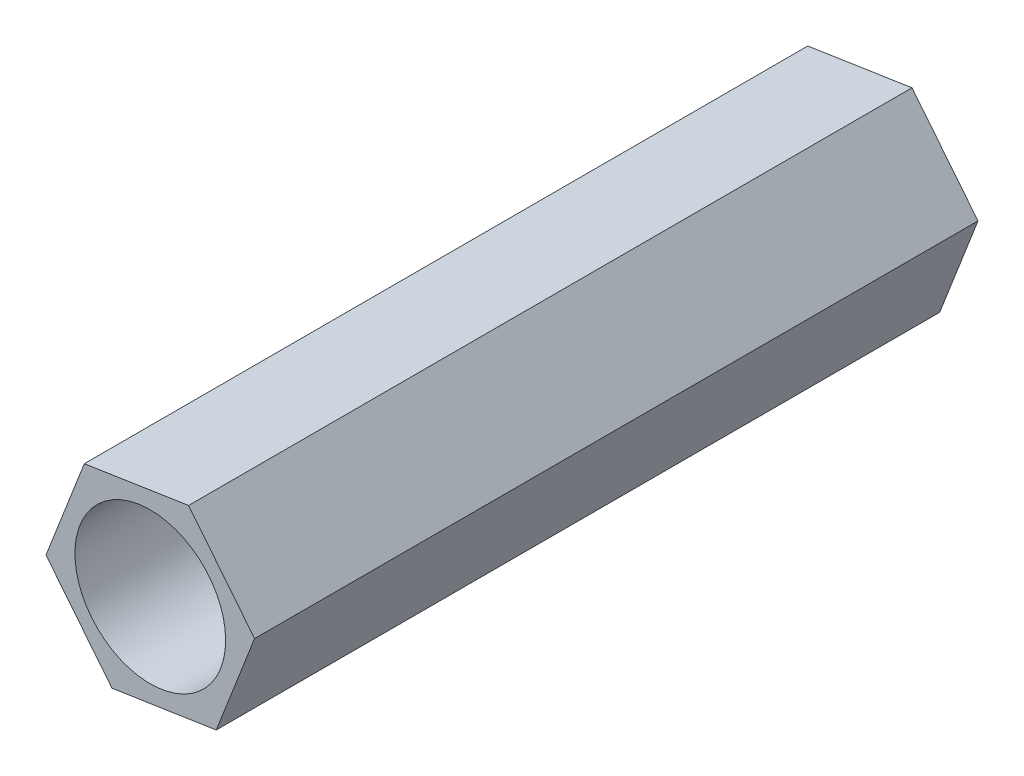
from build123d import *

# Parameters (mm, degrees)
SKETCH1_R           = 1.75
SKETCH1_R_2         = 1.25
BOSS_EXTRUDE1_DEPTH = 12
CUT_EXTRUDE2_START  = -12
CUT_EXTRUDE2_DEPTH  = 12


with BuildPart() as part:
    # Sketch1 → Boss-Extrude1 (new body)
    with BuildSketch(Plane.XY):
        Circle(SKETCH1_R)
        Circle(SKETCH1_R_2, mode=Mode.SUBTRACT)
    extrude(amount=BOSS_EXTRUDE1_DEPTH)

    # Sketch2 → Cut-Extrude2 (cut)
    with BuildSketch(Plane.XY.offset(12).offset(CUT_EXTRUDE2_START)):
        with BuildLine():
            ThreePointArc((-1.09434695, 1.365615156), (-1.630539837, 0.635483942), (-1.729830892, -0.264924681))
            Line((-1.729830892, -0.264924681), (-1.09434695, 1.365615156))
        make_face()
        with BuildLine():
            Line((-1.09434695, 1.365615156), (0.635483942, 1.630539837))
            ThreePointArc((0.635483942, 1.630539837), (-0.264924681, 1.729830892), (-1.09434695, 1.365615156))
        make_face()
        with BuildLine():
            Line((0.635483942, 1.630539837), (1.729830892, 0.264924681))
            ThreePointArc((1.729830892, 0.264924681), (1.365615156, 1.09434695), (0.635483942, 1.630539837))
        make_face()
        with BuildLine():
            Line((1.729830892, 0.264924681), (1.09434695, -1.365615156))
            ThreePointArc((1.09434695, -1.365615156), (1.577594238, -0.757427501), (1.75, 0))
            ThreePointArc((1.75, 0), (1.744950438, 0.132845662), (1.729830892, 0.264924681))
        make_face()
        with BuildLine():
            ThreePointArc((-0.635483942, -1.630539837), (0.264924681, -1.729830892), (1.09434695, -1.365615156))
            Line((1.09434695, -1.365615156), (-0.635483942, -1.630539837))
        make_face()
        with BuildLine():
            ThreePointArc((-1.729830892, -0.264924681), (-1.365615156, -1.09434695), (-0.635483942, -1.630539837))
            Line((-0.635483942, -1.630539837), (-1.729830892, -0.264924681))
        make_face()
    extrude(amount=CUT_EXTRUDE2_DEPTH, mode=Mode.SUBTRACT)


solid = part.part
